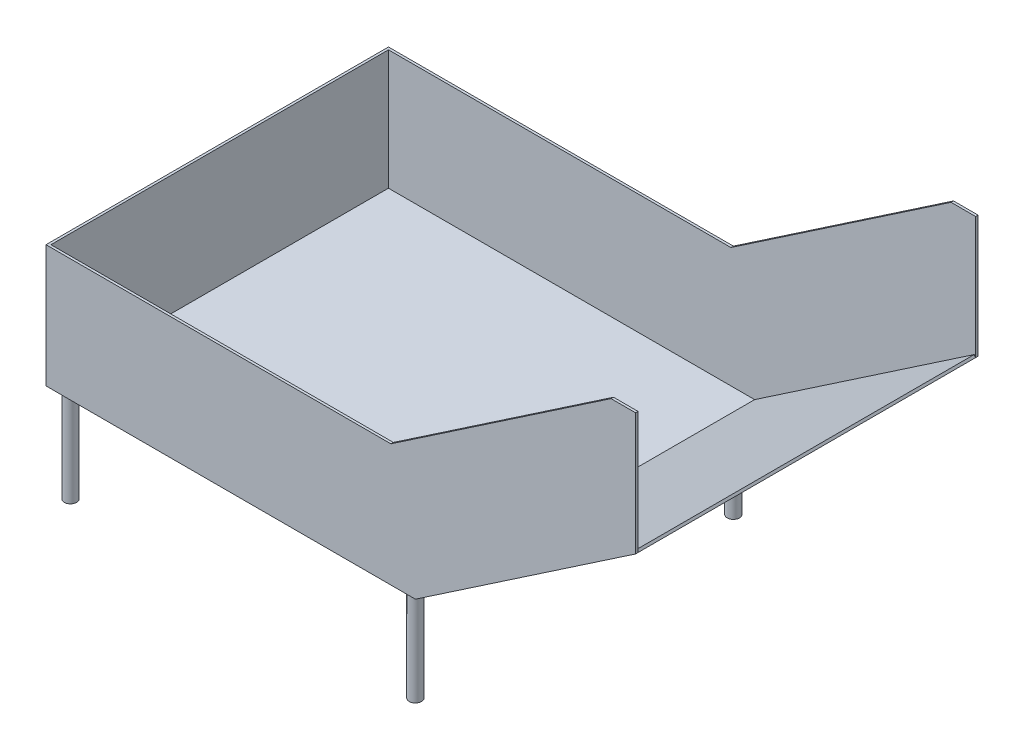
from build123d import *

# Parameters (mm, degrees)
BOSS_EXTRUDE1_DEPTH = 1
SKETCH2_W           = 140
SKETCH2_H           = 50
BOSS_EXTRUDE2_DEPTH = 1
SKETCH3_W           = 151
SKETCH3_H           = 140
BOSS_EXTRUDE3_DEPTH = 1
SKETCH5_W           = 108.724422279
SKETCH5_H           = 140
BOSS_EXTRUDE4_DEPTH = 1
SKETCH6_R           = 2.5
BOSS_EXTRUDE5_DEPTH = 40


with BuildPart() as part:
    # Sketch1 → Boss-Extrude1 (new body)
    with BuildSketch(Plane.XY):
        Polygon((0, 0), (0, 50), (140, 50), (230, 111), (240, 111), (240, 61), (150, 0), align=None)
    boss_extrude1 = extrude(amount=BOSS_EXTRUDE1_DEPTH)

    # Sketch2 → Boss-Extrude2 (add)
    with BuildSketch(Plane.ZY):
        with Locations((-69, 25)):
            Rectangle(SKETCH2_W, SKETCH2_H)
    extrude(amount=BOSS_EXTRUDE2_DEPTH)

    # Mirror1: Boss-Extrude1 across plane
    add(boss_extrude1.mirror(Plane.XY.offset(-69)))

    # Sketch3 → Boss-Extrude3 (add)
    with BuildSketch(Plane.XZ):
        with Locations((74.5, -69)):
            Rectangle(SKETCH3_W, SKETCH3_H)
    extrude(amount=-BOSS_EXTRUDE3_DEPTH)

    # Sketch5 → Boss-Extrude4 (add)
    with BuildSketch(Plane(origin=(47.216817528, -69.664157009, 0), x_dir=(-0.8277808988368524, -0.5610514981005335, 0), z_dir=(0.5610514981005335, -0.8277808988368524, 0))):
        with Locations((-178.529345965, 69)):
            Rectangle(SKETCH5_W, SKETCH5_H)
    extrude(amount=-BOSS_EXTRUDE4_DEPTH)

    # Sketch6 → Boss-Extrude5 (add)
    with BuildSketch(Plane.XZ):
        with Locations(Location((4, -4, 0), (0, 0, 180))):
            Circle(SKETCH6_R)
        with Locations(Location((4, -134, 0), (0, 0, 180))):
            Circle(SKETCH6_R)
        with Locations(Location((145, -4, 0), (0, 0, 180))):
            Circle(SKETCH6_R)
        with Locations(Location((145, -134, 0), (0, 0, 180))):
            Circle(SKETCH6_R)
    extrude(amount=BOSS_EXTRUDE5_DEPTH)


solid = part.part
